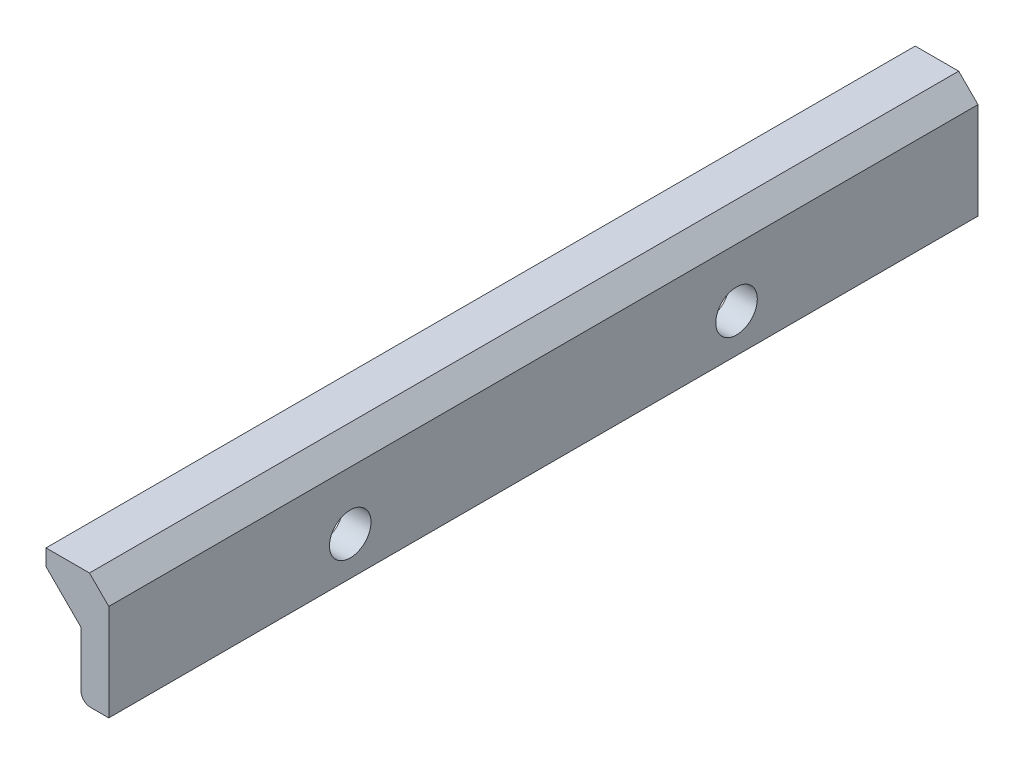
from build123d import *

# Parameters (mm, degrees)
BOSS_EXTRUDE1_DEPTH = 90
CUT_EXTRUDE1_REACH  = 93.029
SKETCH4_R           = 2.15
FILLET1_R           = 1


with BuildPart() as part:
    # Sketch3 → Boss-Extrude1 (new body)
    with BuildSketch(Plane.XY):
        Polygon((3.617157288, -12), (3.617157288, -5.297157288), (0, -1.68), (0, 0), (4.5, 0), (6.5, -2), (6.5, -12), align=None)
    extrude(amount=BOSS_EXTRUDE1_DEPTH)

    # Sketch4 → Cut-Extrude1 (cut, up to next)
    with BuildSketch(Plane(origin=(6.5, 0, 0), x_dir=(0, 0, -1), z_dir=(1, 0, 0)), mode=Mode.PRIVATE) as cut_extrude1_sk1:
        with Locations((-65, -8)):
            Circle(SKETCH4_R)
    cut_extrude1_tool1 = extrude(cut_extrude1_sk1.sketch, amount=-CUT_EXTRUDE1_REACH, mode=Mode.PRIVATE) & part.part
    # Sketch4 → Cut-Extrude1 (cut, up to next)
    with BuildSketch(Plane(origin=(6.5, 0, 0), x_dir=(0, 0, -1), z_dir=(1, 0, 0)), mode=Mode.PRIVATE) as cut_extrude1_sk2:
        with Locations((-25, -8)):
            Circle(SKETCH4_R)
    cut_extrude1_tool2 = extrude(cut_extrude1_sk2.sketch, amount=-CUT_EXTRUDE1_REACH, mode=Mode.PRIVATE) & part.part
    add(cut_extrude1_tool1.solids().sort_by_distance((6.5, -8, 65))[0], mode=Mode.SUBTRACT)
    add(cut_extrude1_tool2.solids().sort_by_distance((6.5, -8, 25))[0], mode=Mode.SUBTRACT)

    # Fillet1
    fillet1_edges = [part.edges().sort_by_distance(p)[0] for p in [
        (3.617157288, -12, 45),
    ]]
    fillet(fillet1_edges, radius=FILLET1_R)


solid = part.part
